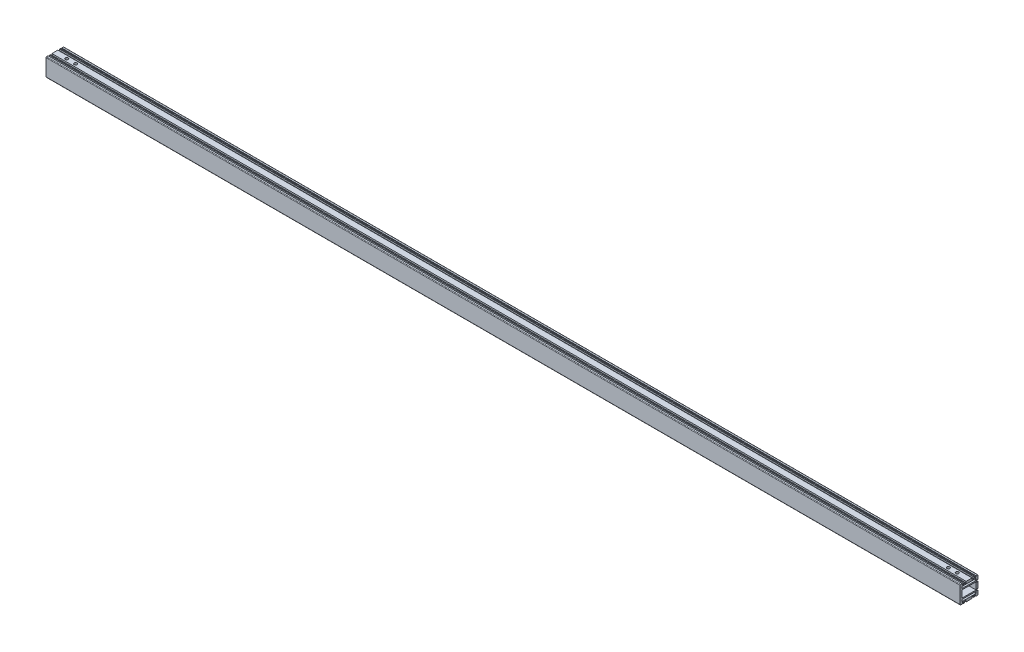
from build123d import *

# Parameters (mm, degrees)
SKETCH_1_W             = 23.5
SKETCH_1_H             = 12
EXTRUDE_1_DEPTH        = 771
HOLE_WIZARD_M6_1_D     = 5
HOLE_WIZARD_M6_1_DEPTH = 15
HOLE_WIZARD_M6_1_TIP   = 1.502151548
HOLE_WIZARD_M6_2_D     = 5
HOLE_WIZARD_M6_2_DEPTH = 15
HOLE_WIZARD_M6_2_TIP   = 1.502151548
HOLE_WIZARD_M6_3_D     = 5
HOLE_WIZARD_M6_3_DEPTH = 15
HOLE_WIZARD_M6_3_TIP   = 1.502151548
HOLE_WIZARD_M6_4_D     = 5
HOLE_WIZARD_M6_4_DEPTH = 15
HOLE_WIZARD_M6_4_TIP   = 1.502151548


with BuildPart() as part:
    # 草图1 → 凸台-拉伸1 (new, symmetric)
    with BuildSketch(Plane(origin=(0, 0, 0), x_dir=(0, 0, -1), z_dir=(1, 0, 0))):
        with BuildLine():
            Line((-14, 15), (-11.5, 15))
            Line((-11.5, 15), (-11.5, 13.5))
            Line((-11.5, 13.5), (-11.4, 13.5))
            ThreePointArc((-11.4, 13.5), (-11.117157288, 13.382842712), (-11, 13.1))
            Line((-11, 13.1), (-11, 12))
            Line((-11, 12), (-9.5, 12))
            Line((-9.5, 12), (-9.5, 15))
            Line((-9.5, 15), (-8, 15))
            Line((-8, 15), (-8, 12.5))
            Line((-8, 12.5), (-5, 12.5))
            Line((-5, 12.5), (-5, 15))
            Line((-5, 15), (5, 15))
            Line((5, 15), (5, 12.5))
            Line((5, 12.5), (8, 12.5))
            Line((8, 12.5), (8, 15))
            Line((8, 15), (9.5, 15))
            Line((9.5, 15), (9.5, 12))
            Line((9.5, 12), (11, 12))
            Line((11, 12), (11, 13.1))
            ThreePointArc((11, 13.1), (11.117157288, 13.382842712), (11.4, 13.5))
            Line((11.4, 13.5), (11.5, 13.5))
            Line((11.5, 13.5), (11.5, 15))
            Line((11.5, 15), (14, 15))
            ThreePointArc((14, 15), (14.707106781, 14.707106781), (15, 14))
            Line((15, 14), (15, 8))
            Line((15, 8), (12.5, 8))
            Line((12.5, 8), (12.5, 5))
            Line((12.5, 5), (15, 5))
            Line((15, 5), (15, -5))
            Line((15, -5), (12.5, -5))
            Line((12.5, -5), (12.5, -8))
            Line((12.5, -8), (15, -8))
            Line((15, -8), (15, -14))
            ThreePointArc((15, -14), (14.707106781, -14.707106781), (14, -15))
            Line((14, -15), (11.5, -15))
            Line((11.5, -15), (11.5, -13.5))
            Line((11.5, -13.5), (11.4, -13.5))
            ThreePointArc((11.4, -13.5), (11.117157288, -13.382842712), (11, -13.1))
            Line((11, -13.1), (11, -12))
            Line((11, -12), (9.5, -12))
            Line((9.5, -12), (9.5, -15))
            Line((9.5, -15), (8, -15))
            Line((8, -15), (8, -12.5))
            Line((8, -12.5), (5, -12.5))
            Line((5, -12.5), (5, -15))
            Line((5, -15), (-5, -15))
            Line((-5, -15), (-5, -12.5))
            Line((-5, -12.5), (-8, -12.5))
            Line((-8, -12.5), (-8, -15))
            Line((-8, -15), (-9.5, -15))
            Line((-9.5, -15), (-9.5, -12))
            Line((-9.5, -12), (-11, -12))
            Line((-11, -12), (-11, -13.1))
            ThreePointArc((-11, -13.1), (-11.117157288, -13.382842712), (-11.4, -13.5))
            Line((-11.4, -13.5), (-11.5, -13.5))
            Line((-11.5, -13.5), (-11.5, -15))
            Line((-11.5, -15), (-14, -15))
            ThreePointArc((-14, -15), (-14.707106781, -14.707106781), (-15, -14))
            Line((-15, -14), (-15, 14))
            ThreePointArc((-15, 14), (-14.707106781, 14.707106781), (-14, 15))
        make_face()
        with BuildLine():
            Line((12, -10.5), (12, -8.5))
            ThreePointArc((12, -8.5), (11.853553391, -8.146446609), (11.5, -8))
            Line((11.5, -8), (-11.5, -8))
            ThreePointArc((-11.5, -8), (-11.853553391, -8.146446609), (-12, -8.5))
            Line((-12, -8.5), (-12, -10.5))
            ThreePointArc((-12, -10.5), (-11.853553391, -10.853553391), (-11.5, -11))
            Line((-11.5, -11), (11.5, -11))
            ThreePointArc((11.5, -11), (11.853553391, -10.853553391), (12, -10.5))
        make_face(mode=Mode.SUBTRACT)
        with BuildLine():
            Line((-11.5, 11), (11.5, 11))
            ThreePointArc((11.5, 11), (11.853553391, 10.853553391), (12, 10.5))
            Line((12, 10.5), (12, 8.5))
            ThreePointArc((12, 8.5), (11.853553391, 8.146446609), (11.5, 8))
            Line((11.5, 8), (-11.5, 8))
            ThreePointArc((-11.5, 8), (-11.853553391, 8.146446609), (-12, 8.5))
            Line((-12, 8.5), (-12, 10.5))
            ThreePointArc((-12, 10.5), (-11.853553391, 10.853553391), (-11.5, 11))
        make_face(mode=Mode.SUBTRACT)
        Rectangle(SKETCH_1_W, SKETCH_1_H, mode=Mode.SUBTRACT)
    extrude(amount=EXTRUDE_1_DEPTH, both=True)

    # M6 螺纹孔1
    with Locations(Plane(origin=(0, 15, 0), x_dir=(-1, 0, 0), z_dir=(0, 1, 0))):
        with Locations((-751, 0), (-736, 0), (736, 0), (751, 0)):
            Hole(HOLE_WIZARD_M6_1_D / 2, depth=HOLE_WIZARD_M6_1_DEPTH)
            with Locations((0, 0, -(HOLE_WIZARD_M6_1_DEPTH + HOLE_WIZARD_M6_1_TIP / 2))):  # 118° drill point
                Cone(0, HOLE_WIZARD_M6_1_D / 2, HOLE_WIZARD_M6_1_TIP, mode=Mode.SUBTRACT)

    # M6 螺纹孔2
    with Locations(Plane(origin=(0, 0, -15), x_dir=(-1, 0, 0), z_dir=(0, 0, -1))):
        with Locations((-751, 0), (-736, 0), (736, 0), (751, 0)):
            Hole(HOLE_WIZARD_M6_2_D / 2, depth=HOLE_WIZARD_M6_2_DEPTH)
            with Locations((0, 0, -(HOLE_WIZARD_M6_2_DEPTH + HOLE_WIZARD_M6_2_TIP / 2))):  # 118° drill point
                Cone(0, HOLE_WIZARD_M6_2_D / 2, HOLE_WIZARD_M6_2_TIP, mode=Mode.SUBTRACT)

    # M6 螺纹孔3
    with Locations(Plane.XZ.offset(15)):
        with Locations((751, 0), (736, 0), (-736, 0), (-751, 0)):
            Hole(HOLE_WIZARD_M6_3_D / 2, depth=HOLE_WIZARD_M6_3_DEPTH)
            with Locations((0, 0, -(HOLE_WIZARD_M6_3_DEPTH + HOLE_WIZARD_M6_3_TIP / 2))):  # 118° drill point
                Cone(0, HOLE_WIZARD_M6_3_D / 2, HOLE_WIZARD_M6_3_TIP, mode=Mode.SUBTRACT)

    # M6 螺纹孔4
    with Locations(Plane(origin=(0, 0, -15), x_dir=(-1, 0, 0), z_dir=(0, 0, -1))):
        with Locations((411, 0), (351, 0), (-411, 0), (-351, 0)):
            Hole(HOLE_WIZARD_M6_4_D / 2, depth=HOLE_WIZARD_M6_4_DEPTH)
            with Locations((0, 0, -(HOLE_WIZARD_M6_4_DEPTH + HOLE_WIZARD_M6_4_TIP / 2))):  # 118° drill point
                Cone(0, HOLE_WIZARD_M6_4_D / 2, HOLE_WIZARD_M6_4_TIP, mode=Mode.SUBTRACT)


solid = part.part
